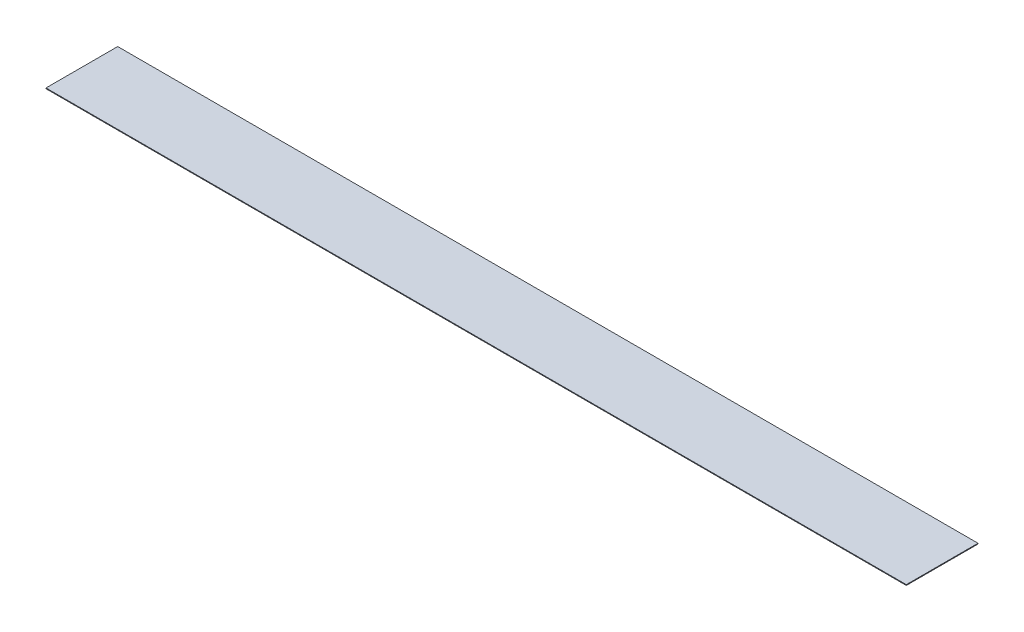
from build123d import *

# Parameters (mm, degrees)
SKETCH7_W           = 3048
SKETCH7_H           = 254
BOSS_EXTRUDE1_DEPTH = 2.54


with BuildPart() as part:
    # Sketch7 → Boss-Extrude1 (new body)
    with BuildSketch(Plane(origin=(0, 0, 0), x_dir=(1, 0, 0), z_dir=(0, 1, 0))):
        Rectangle(SKETCH7_W, SKETCH7_H)
    extrude(amount=BOSS_EXTRUDE1_DEPTH)


solid = part.part
